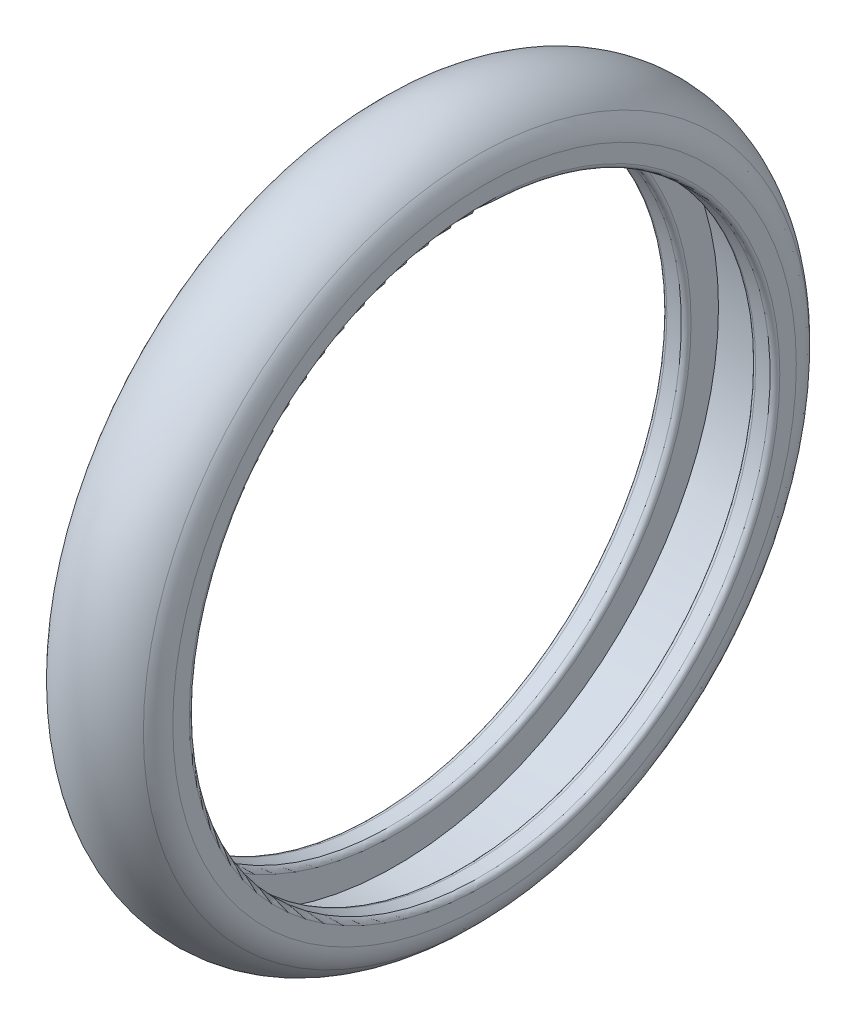
from build123d import *

# Parameters (mm, degrees)
VERRUNDUNG1_R = 2
VERRUNDUNG2_R = 0.3


with BuildPart() as part:
    # Skizze2 → Rotation1 (revolve)
    with BuildSketch(Plane.XY, mode=Mode.PRIVATE) as rotation1_sk:
        with BuildLine():
            Line((2, 20), (-2, 20))
            Line((-2, 20), (-2, 18))
            Line((-2, 18), (-3.5, 18))
            Line((-3.5, 18), (-3.5, 19.936491673))
            ThreePointArc((-3.5, 19.936491673), (0, 22), (3.5, 19.936491673))
            Line((3.5, 19.936491673), (3.5, 18))
            Line((3.5, 18), (2, 18))
            Line((2, 18), (2, 20))
        make_face()
    revolve(rotation1_sk.sketch.rotate(Axis((0, 0, 0), (1, 0, 0)), 90), axis=Axis((0, 0, 0), (1, 0, 0)))

    # Verrundung1
    verrundung1_edges = [part.edges().sort_by_distance(p)[0] for p in [
        (3.5, 0, -19.936491673),
        (-3.5, 0, -19.936491673),
    ]]
    fillet(verrundung1_edges, radius=VERRUNDUNG1_R)

    # Verrundung2
    verrundung2_edges = [part.edges().sort_by_distance(p)[0] for p in [
        (3.5, 0, -18),
        (-3.5, 0, -18),
        (-2, 0, -18),
        (2, 0, -18),
    ]]
    fillet(verrundung2_edges, radius=VERRUNDUNG2_R)


solid = part.part
